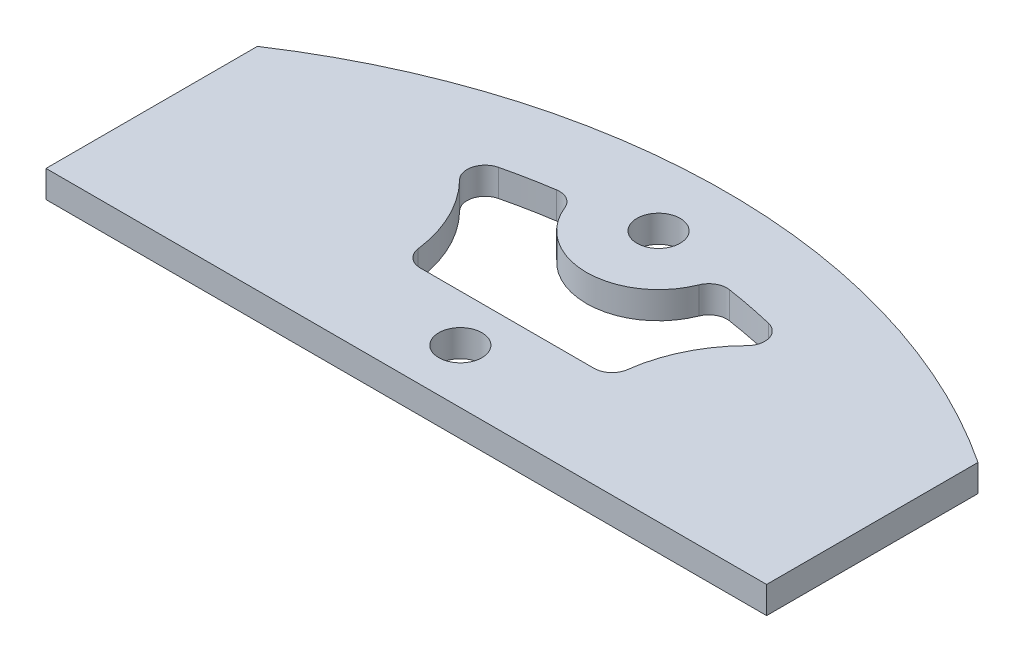
from build123d import *

# Parameters (mm, degrees)
BOSS_EXTRUDE1_DEPTH  = 3
CUT_EXTRUDE14_DEPTH  = 103.574363269
SKETCH14_OUTSIDE_W   = 186.736
SKETCH14_OUTSIDE_H   = 177.534
SKETCH14_OUTSIDE_W_2 = 80
SKETCH14_OUTSIDE_H_2 = 40
CUT_EXTRUDE15_DEPTH  = 103.574363269
SKETCH15_R           = 2.4
CUT_EXTRUDE16_DEPTH  = 83.856804186


with BuildPart() as part:
    # Sketch1 → Boss-Extrude1 (new body)
    with BuildSketch(Plane(origin=(0, 0, 0), x_dir=(1, 0, 0), z_dir=(0, 1, 0))):
        with BuildLine():
            ThreePointArc((36.543377003, -62.616544118), (0, 72.5), (-36.543377003, -62.616544118))
            ThreePointArc((-36.543377003, -62.616544118), (-33.085954668, -63.20954405), (-30.089832649, -61.38507948))
            ThreePointArc((-30.089832649, -61.38507948), (0, -46.75), (30.089832649, -61.38507948))
            ThreePointArc((30.089832649, -61.38507948), (33.085954668, -63.20954405), (36.543377003, -62.616544118))
        make_face()
    extrude(amount=BOSS_EXTRUDE1_DEPTH)

    # Sketch13 → Cut-Extrude14 (cut, through all)
    with BuildSketch(Plane(origin=(0, 3, 0), x_dir=(1, 0, 0), z_dir=(0, 1, 0))):
        with BuildLine():
            ThreePointArc((-11.622969422, 49.948571429), (-10.961172041, 48.699523885), (-9.638836445, 48.2))
            Line((-9.638836445, 48.2), (9.638836445, 48.2))
            ThreePointArc((9.638836445, 48.2), (10.961172041, 48.699523885), (11.622969422, 49.948571429))
            ThreePointArc((11.622969422, 49.948571429), (13.054510917, 54.765599326), (15.951885484, 58.871484058))
            ThreePointArc((15.951885484, 58.871484058), (16.449270482, 60.8240474), (14.994913363, 62.21858704))
            ThreePointArc((14.994913363, 62.21858704), (12.303854546, 62.806171379), (9.590005203, 63.277419355))
            ThreePointArc((9.590005203, 63.277419355), (8.295362524, 63.03495375), (7.432254032, 62.04))
            ThreePointArc((7.432254032, 62.04), (0, 57), (-7.432254032, 62.04))
            ThreePointArc((-7.432254032, 62.04), (-8.295362524, 63.03495375), (-9.590005203, 63.277419355))
            ThreePointArc((-9.590005203, 63.277419355), (-12.303854546, 62.806171379), (-14.994913363, 62.21858704))
            ThreePointArc((-14.994913363, 62.21858704), (-16.449270482, 60.8240474), (-15.951885484, 58.871484058))
            ThreePointArc((-15.951885484, 58.871484058), (-13.054510917, 54.765599326), (-11.622969422, 49.948571429))
        make_face()
    extrude(amount=-CUT_EXTRUDE14_DEPTH, mode=Mode.SUBTRACT)

    # Sketch14 outside → Cut-Extrude15 (cut, through all)
    with BuildSketch(Plane(origin=(0, 3, 0), x_dir=(1, 0, 0), z_dir=(0, 1, 0))):
        with Locations((0, 4.601)):
            Rectangle(SKETCH14_OUTSIDE_W, SKETCH14_OUTSIDE_H)
        with Locations((0, 57)):
            Rectangle(SKETCH14_OUTSIDE_W_2, SKETCH14_OUTSIDE_H_2, mode=Mode.SUBTRACT)
    extrude(amount=-CUT_EXTRUDE15_DEPTH, mode=Mode.SUBTRACT)

    # Sketch15 → Cut-Extrude16 (cut, through all)
    with BuildSketch(Plane(origin=(0, 3, 0), x_dir=(1, 0, 0), z_dir=(0, 1, 0))):
        with Locations((0, 65)):
            Circle(SKETCH15_R)
        with Locations((0, 43)):
            Circle(SKETCH15_R)
    extrude(amount=-CUT_EXTRUDE16_DEPTH, mode=Mode.SUBTRACT)


solid = part.part
